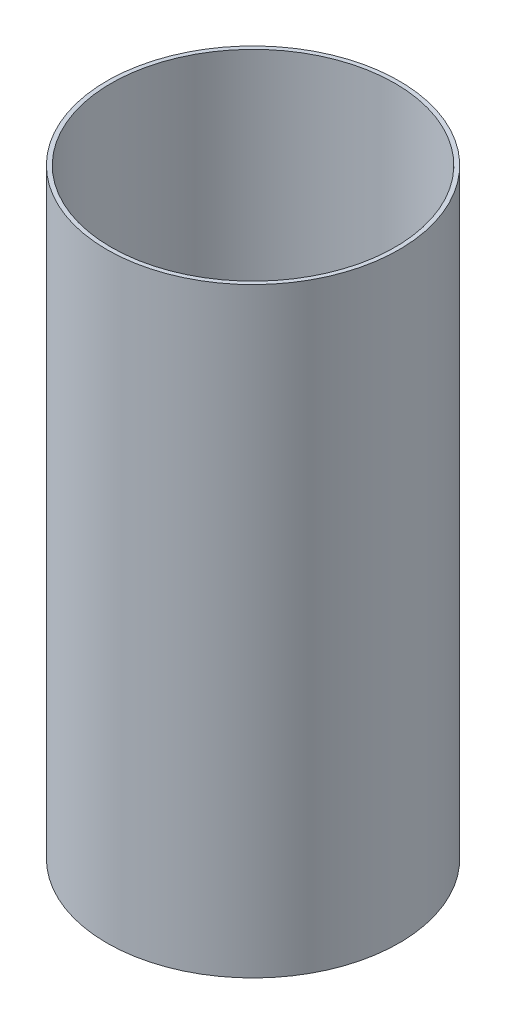
from build123d import *

# Parameters (mm, degrees)
SKETCH1_R           = 49.4538
SKETCH1_R_2         = 48.0441
BOSS_EXTRUDE1_DEPTH = 101.6


with BuildPart() as part:
    # Sketch1 → Boss-Extrude1 (new, symmetric)
    with BuildSketch(Plane(origin=(0, 0, 0), x_dir=(1, 0, 0), z_dir=(0, 1, 0))):
        with Locations(Location((0, 0, 0), (0, 0, 270))):
            Circle(SKETCH1_R)
        with Locations(Location((0, 0, 0), (0, 0, 270))):
            Circle(SKETCH1_R_2, mode=Mode.SUBTRACT)
    extrude(amount=BOSS_EXTRUDE1_DEPTH, both=True)


solid = part.part
